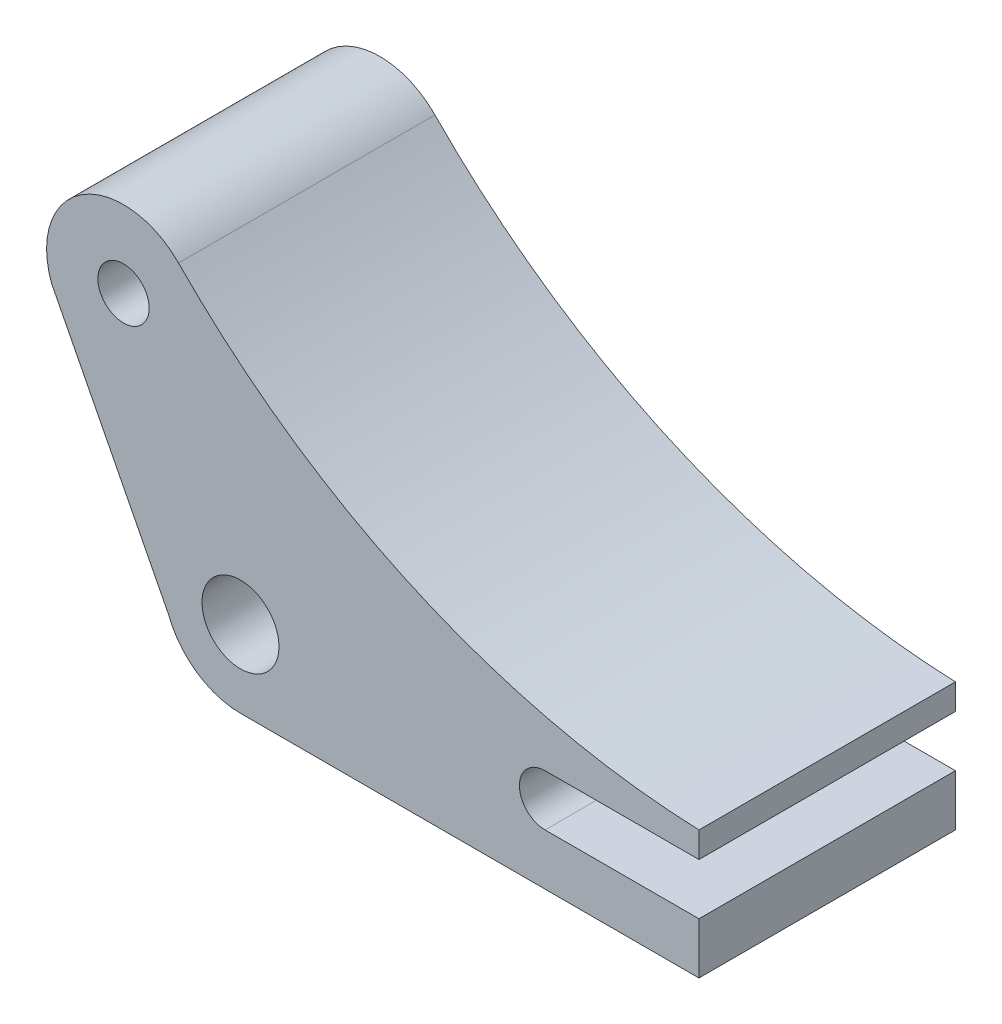
from build123d import *

# Parameters (mm, degrees)
SKETCH3_R           = 15
SKETCH3_R_2         = 10
BOSS_EXTRUDE1_DEPTH = 50


with BuildPart() as part:
    # Sketch3 → Boss-Extrude1 (new, symmetric)
    with BuildSketch(Plane.XY):
        with BuildLine():
            ThreePointArc((-28.016593122, -10.72709233), (-17.002753161, -24.716520486), (0, -30))
            Line((0, -30), (178.761781376, -30))
            Line((178.761781376, -30), (178.761781376, -10))
            Line((178.761781376, -10), (118.761781376, -10))
            ThreePointArc((118.761781376, -10), (108.761781376, 0), (118.761781376, 10))
            Line((118.761781376, 10), (178.761781376, 10))
            Line((178.761781376, 10), (178.761781376, 20))
            ThreePointArc((178.761781376, 20), (68.667725633, 45.525627999), (-24.170625815, 109.971724042))
            ThreePointArc((-24.170625815, 109.971724042), (-61.804778357, 114.246632888), (-73.630323726, 78.263848671))
            Line((-73.630323726, 78.263848671), (-70.680690942, 72.509208706))
            Line((-70.680690942, 72.509208706), (-28.016593122, -10.72709233))
        make_face()
        Circle(SKETCH3_R, mode=Mode.SUBTRACT)
        with Locations((-45.613730605, 88.990941002)):
            Circle(SKETCH3_R_2, mode=Mode.SUBTRACT)
    extrude(amount=BOSS_EXTRUDE1_DEPTH, both=True)


solid = part.part
